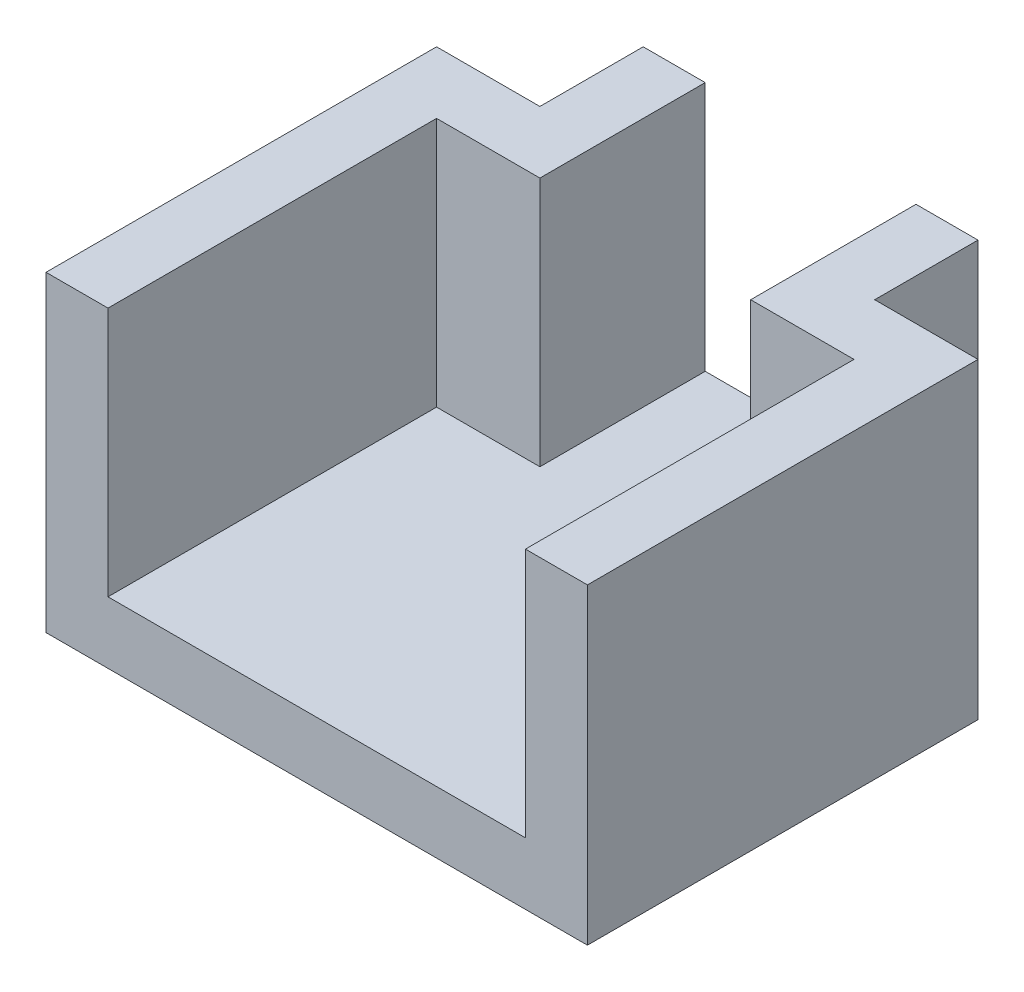
from build123d import *

# Parameters (mm, degrees)
BOSS_EXTRUDE1_DEPTH = 3
BOSS_EXTRUDE2_DEPTH = 15.1


with BuildPart() as part:
    # Sketch1 → Boss-Extrude1 (new body)
    with BuildSketch(Plane(origin=(0, 0, 0), x_dir=(1, 0, 0), z_dir=(0, 1, 0))):
        Polygon((2, 0), (2, -5), (-3, -5), (-3, -23.9), (23.2, -23.9), (23.2, -5), (18.2, -5), (18.2, 0), align=None)
    extrude(amount=BOSS_EXTRUDE1_DEPTH)

    # Sketch1<3> → Boss-Extrude2 (add)
    with BuildSketch(Plane(origin=(0, 0, 0), x_dir=(1, 0, 0), z_dir=(0, 1, 0))):
        Polygon((5, -8), (5, 0), (2, 0), (2, -5), (-3, -5), (-3, -23.9), (0, -23.9), (0, -8), align=None)
        Polygon((18.2, 0), (15.2, 0), (15.2, -8), (20.2, -8), (20.2, -23.9), (23.2, -23.9), (23.2, -5), (18.2, -5), align=None)
    extrude(amount=BOSS_EXTRUDE2_DEPTH)


solid = part.part
